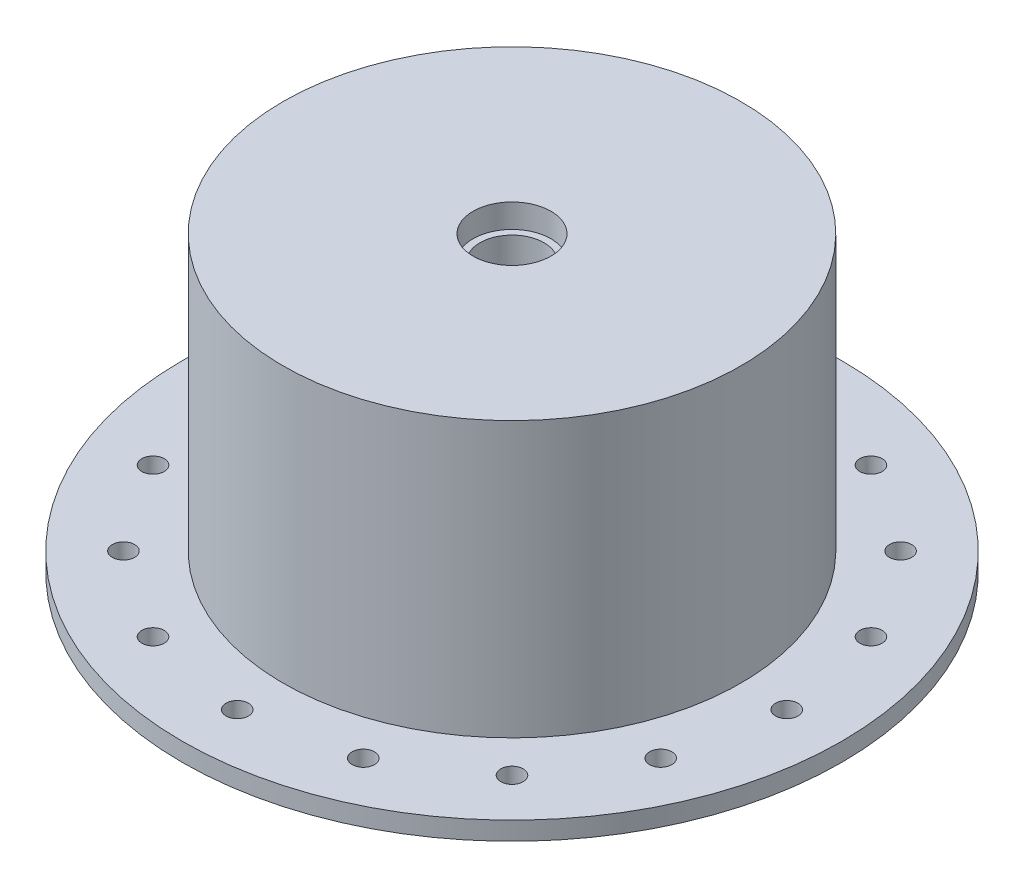
from build123d import *

# Parameters (mm, degrees)
CUT_EXTRUDE1_DEPTH      = 296.465734054
CUT_EXTRUDE1_DEPTH_BACK = 296.465734054
SKETCH2_R               = 6.1


with BuildPart() as part:
    # Sketch1 → Revolve1 (revolve)
    with BuildSketch(Plane.XY):
        Polygon((-21.25, -80), (-21.25, -67), (-17.5, -67), (-17.5, 67), (-21.25, 67), (-21.25, 80), (-42.5, 80), (-125, 80), (-125, 70), (-125, -70), (-180, -70), (-180, -80), (-42.5, -80), align=None)
    revolve(axis=Axis((0, 80, 0), (0, -1, 0)))

    # Sketch2 → Cut-Extrude1 (cut, two sides: drawn at the far end of the back side and taken through both)
    with BuildSketch(Plane(origin=(0, -70, 0), x_dir=(1, 0, 0), z_dir=(0, 1, 0)).offset(-CUT_EXTRUDE1_DEPTH_BACK)):
        with Locations(Location((0, 150, 0), (0, 0, 270))):
            Circle(SKETCH2_R)
        with Locations(Location((57.402514855, 138.581929877, 0), (0, 0, 270))):
            Circle(SKETCH2_R)
        with Locations(Location((106.066017178, 106.066017178, 0), (0, 0, 270))):
            Circle(SKETCH2_R)
        with Locations(Location((138.581929877, 57.402514855, 0), (0, 0, 270))):
            Circle(SKETCH2_R)
        with Locations(Location((150, 0, 0), (0, 0, 270))):
            Circle(SKETCH2_R)
        with Locations(Location((138.581929877, -57.402514855, 0), (0, 0, 270))):
            Circle(SKETCH2_R)
        with Locations(Location((106.066017178, -106.066017178, 0), (0, 0, 270))):
            Circle(SKETCH2_R)
        with Locations(Location((57.402514855, -138.581929877, 0), (0, 0, 270))):
            Circle(SKETCH2_R)
        with Locations(Location((0, -150, 0), (0, 0, 270))):
            Circle(SKETCH2_R)
        with Locations(Location((-57.402514855, -138.581929877, 0), (0, 0, 270))):
            Circle(SKETCH2_R)
        with Locations(Location((-106.066017178, -106.066017178, 0), (0, 0, 270))):
            Circle(SKETCH2_R)
        with Locations(Location((-138.581929877, -57.402514855, 0), (0, 0, 270))):
            Circle(SKETCH2_R)
        with Locations(Location((-150, 0, 0), (0, 0, 270))):
            Circle(SKETCH2_R)
        with Locations(Location((-138.581929877, 57.402514855, 0), (0, 0, 270))):
            Circle(SKETCH2_R)
        with Locations(Location((-106.066017178, 106.066017178, 0), (0, 0, 270))):
            Circle(SKETCH2_R)
        with Locations(Location((-57.402514855, 138.581929877, 0), (0, 0, 270))):
            Circle(SKETCH2_R)
    extrude(amount=CUT_EXTRUDE1_DEPTH + CUT_EXTRUDE1_DEPTH_BACK, mode=Mode.SUBTRACT)


solid = part.part
